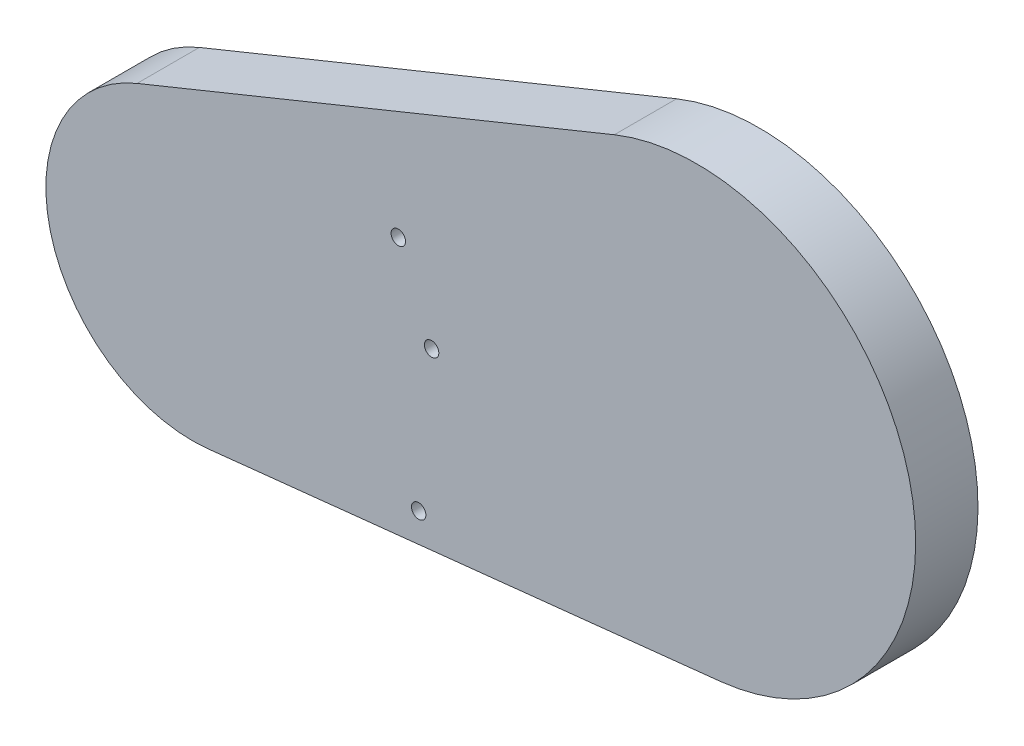
from build123d import *

# Parameters (mm, degrees)
SKETCH1_R           = 3.175
BOSS_EXTRUDE1_DEPTH = 27.435
SHELL1_T            = -2.54


with BuildPart() as part:
    # Sketch1 → Boss-Extrude1 (new body)
    with BuildSketch(Plane.XY):
        with BuildLine():
            Line((-246.406013588, 3.788089061), (-36.31395184, 89.260287536))
            ThreePointArc((-36.31395184, 89.260287536), (93.454251213, 23.503296779), (10.232750038, -95.819584929))
            Line((10.232750038, -95.819584929), (-215.29793902, -119.904422791))
            ThreePointArc((-215.29793902, -119.904422791), (-284.593997313, -71.574027866), (-246.406013588, 3.788089061))
        make_face()
        with Locations(Location((-131.38650471, 2.593989183, 0), (0, 0, 180))):
            Circle(SKETCH1_R, mode=Mode.SUBTRACT)
        with Locations(Location((-116.729233004, -32.575302177, 0), (0, 0, 180))):
            Circle(SKETCH1_R, mode=Mode.SUBTRACT)
        with Locations(Location((-122.41902156, -97.213498796, 0), (0, 0, 180))):
            Circle(SKETCH1_R, mode=Mode.SUBTRACT)
    extrude(amount=BOSS_EXTRUDE1_DEPTH)

    # Shell1
    shell1_openings = [part.faces().sort_by_distance(p)[0] for p in [
        (-83.986643927, -21.103730923, 0),
    ]]
    offset(amount=SHELL1_T, openings=shell1_openings, kind=Kind.INTERSECTION)


solid = part.part
